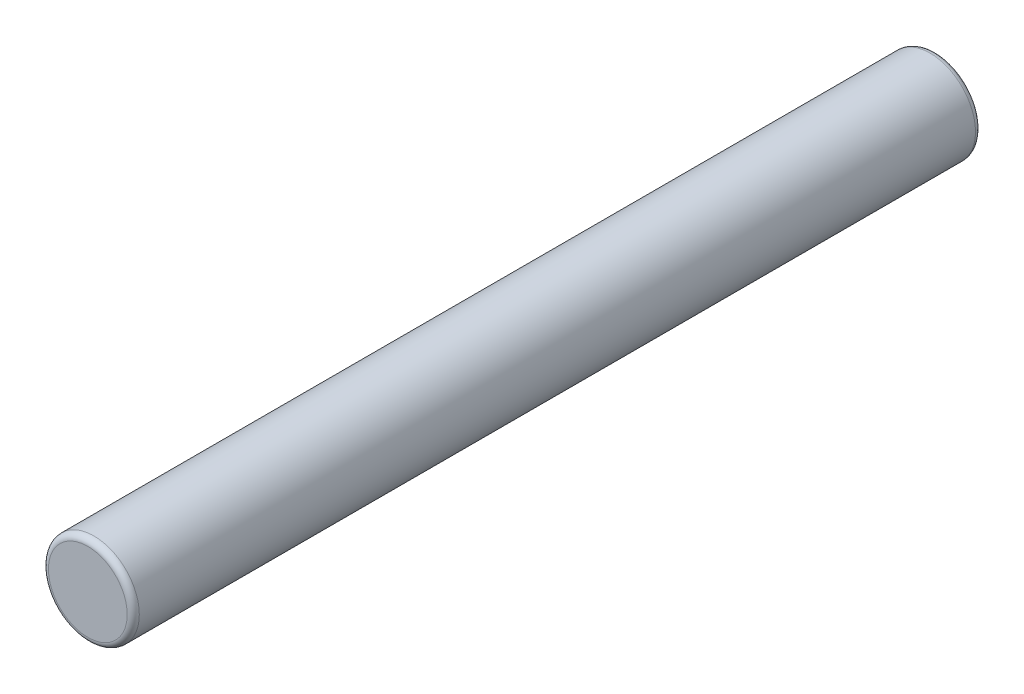
from build123d import *

# Parameters (mm, degrees)
SKETCH1_R      = 0.75
EXTRUDE1_DEPTH = 14
FILLET1_R      = 0.1


with BuildPart() as part:
    # Sketch1 → Extrude1 (new body)
    with BuildSketch(Plane.XY):
        Circle(SKETCH1_R)
    extrude(amount=EXTRUDE1_DEPTH)

    # Fillet1
    fillet1_edges = [part.edges().sort_by_distance(p)[0] for p in [
        (-0.75, 0, 0),
        (-0.75, 0, 14),
    ]]
    fillet(fillet1_edges, radius=FILLET1_R)


solid = part.part
